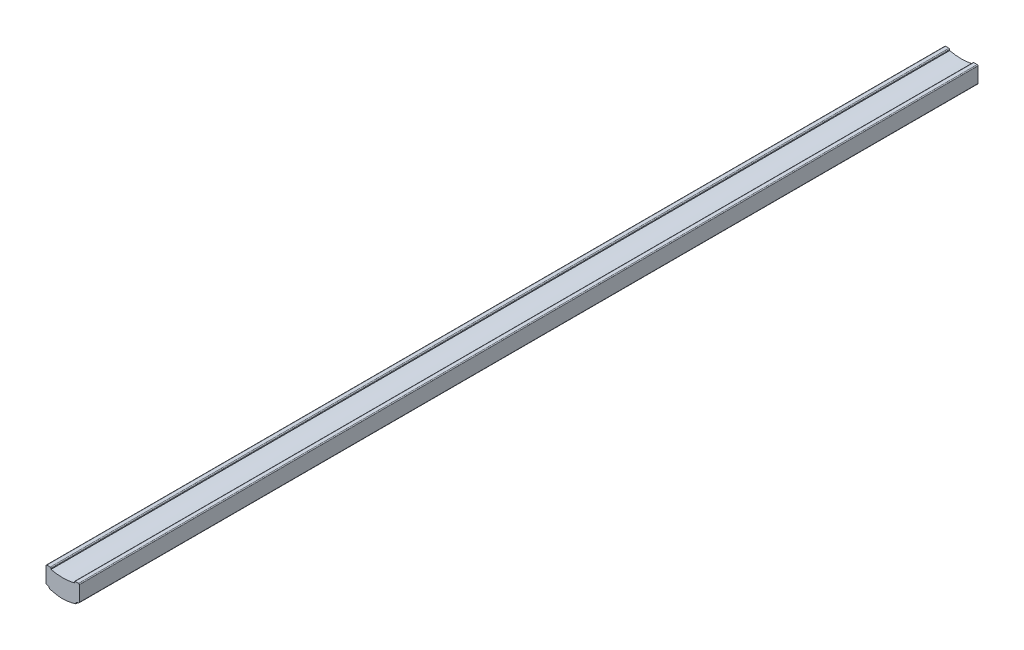
from build123d import *

# Parameters (mm, degrees)
SALIENTE_EXTRUIR1_DEPTH = 540


with BuildPart() as part:
    # Croquis1 → Saliente-Extruir1 (new body)
    with BuildSketch(Plane.XY):
        with BuildLine():
            ThreePointArc((-13.23096405, 11.648445498), (-13.584517441, 11.501998889), (-13.73096405, 11.148445498))
            Line((-13.73096405, 11.148445498), (-13.73096405, 2.035658412))
            ThreePointArc((-13.73096405, 2.035658412), (-13.626281451, 1.729514406), (-13.356067441, 1.551562201))
            Line((-13.356067441, 1.551562201), (-12.169475815, 1.244915231))
            ThreePointArc((-12.169475815, 1.244915231), (-11.899261805, 1.066963026), (-11.794579206, 0.76081902))
            Line((-11.794579206, 0.76081902), (-11.794579206, 0.442917518))
            ThreePointArc((-11.794579206, 0.442917518), (-11.736179814, 0.265071669), (-11.583718232, 0.156466416))
            ThreePointArc((-11.583718232, 0.156466416), (-7.701884055, -0.773383829), (-3.73096405, -1.17965021))
            ThreePointArc((-3.73096405, -1.17965021), (0.239955955, -0.773383829), (4.121790132, 0.156466416))
            ThreePointArc((4.121790132, 0.156466416), (4.274251714, 0.265071669), (4.332651106, 0.442917518))
            Line((4.332651106, 0.442917518), (4.332651106, 0.76081902))
            ThreePointArc((4.332651106, 0.76081902), (4.437333704, 1.066963026), (4.707547715, 1.244915231))
            Line((4.707547715, 1.244915231), (5.894139341, 1.551562201))
            ThreePointArc((5.894139341, 1.551562201), (6.164353351, 1.729514406), (6.26903595, 2.035658412))
            Line((6.26903595, 2.035658412), (6.26903595, 11.148445498))
            ThreePointArc((6.26903595, 11.148445498), (6.12258934, 11.501998889), (5.76903595, 11.648445498))
            Line((5.76903595, 11.648445498), (3.76903595, 11.648445498))
            ThreePointArc((3.76903595, 11.648445498), (3.415482559, 11.501998889), (3.26903595, 11.148445498))
            Line((3.26903595, 11.148445498), (3.26903595, 10.648445498))
            ThreePointArc((3.26903595, 10.648445498), (-0.206558338, 10.028093004), (-3.73096405, 9.82034979))
            ThreePointArc((-3.73096405, 9.82034979), (-7.255369763, 10.028093004), (-10.73096405, 10.648445498))
            Line((-10.73096405, 10.648445498), (-10.73096405, 11.148445498))
            ThreePointArc((-10.73096405, 11.148445498), (-10.87741066, 11.501998889), (-11.23096405, 11.648445498))
            Line((-11.23096405, 11.648445498), (-13.23096405, 11.648445498))
        make_face()
    extrude(amount=SALIENTE_EXTRUIR1_DEPTH)


solid = part.part
